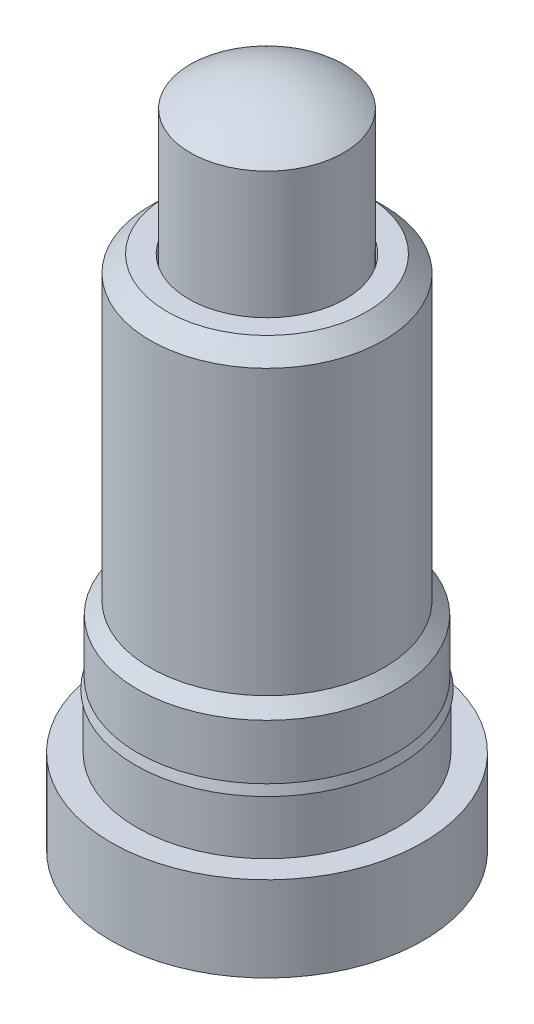
from build123d import *

# Parameters (mm, degrees)
BOSS_EXTRUDE1_START = -0.762
SKETCH4_R           = 2.3749
BOSS_EXTRUDE1_DEPTH = 0.762


with BuildPart() as part:
    # Sketch2 → Revolve1 (revolve)
    with BuildSketch(Plane.XY, mode=Mode.PRIVATE) as revolve1_sk:
        Polygon((-1.3589, 6.5786), (-1.3589, 0), (-2.3749, 0), (-2.3749, 1.2954), (-1.9812, 1.2954), (-1.9812, 2.132354432), (-2.0066, 2.132354432), (-1.9685, 2.274545568), (-1.9685, 3.1115), (-1.778, 3.302), (-1.778, 7.62), (-1.524, 7.874), (-1.1938, 7.874), (-1.1938, 6.7437), align=None)
    revolve(revolve1_sk.sketch.rotate(Axis((0, -1.383294113, 0), (0, 1, 0)), 270), axis=Axis((0, -1.383294113, 0), (0, 1, 0)))

    # Sketch4 → Boss-Extrude1 (add)
    with BuildSketch(Plane.XZ.offset(BOSS_EXTRUDE1_START)):
        with Locations(Location((0, 0, 0), (0, 0, 270))):
            Circle(SKETCH4_R)
    extrude(amount=BOSS_EXTRUDE1_DEPTH)


with BuildPart() as body_2:
    # Sketch3 → Revolve2 (revolve)
    with BuildSketch(Plane.XY, mode=Mode.PRIVATE) as revolve2_sk:
        with BuildLine():
            Line((-1.1684, 6.7691), (-1.1684, 9.790487726))
            ThreePointArc((-1.1684, 9.790487726), (-0.612718916, 10.065420845), (0, 10.16))
            Line((0, 10.16), (0, 8.89))
            Line((0, 8.89), (-1.0414, 8.28874743))
            Line((-1.0414, 8.28874743), (-1.0414, 5.842))
            Line((-1.0414, 5.842), (-1.3335, 5.842))
            Line((-1.3335, 5.842), (-1.3335, 6.604))
            Line((-1.3335, 6.604), (-1.1684, 6.7691))
        make_face()
    revolve(revolve2_sk.sketch.rotate(Axis((0, -1.383294113, 0), (0, 1, 0)), 270), axis=Axis((0, -1.383294113, 0), (0, 1, 0)))


solid = Compound([part.part, body_2.part])
